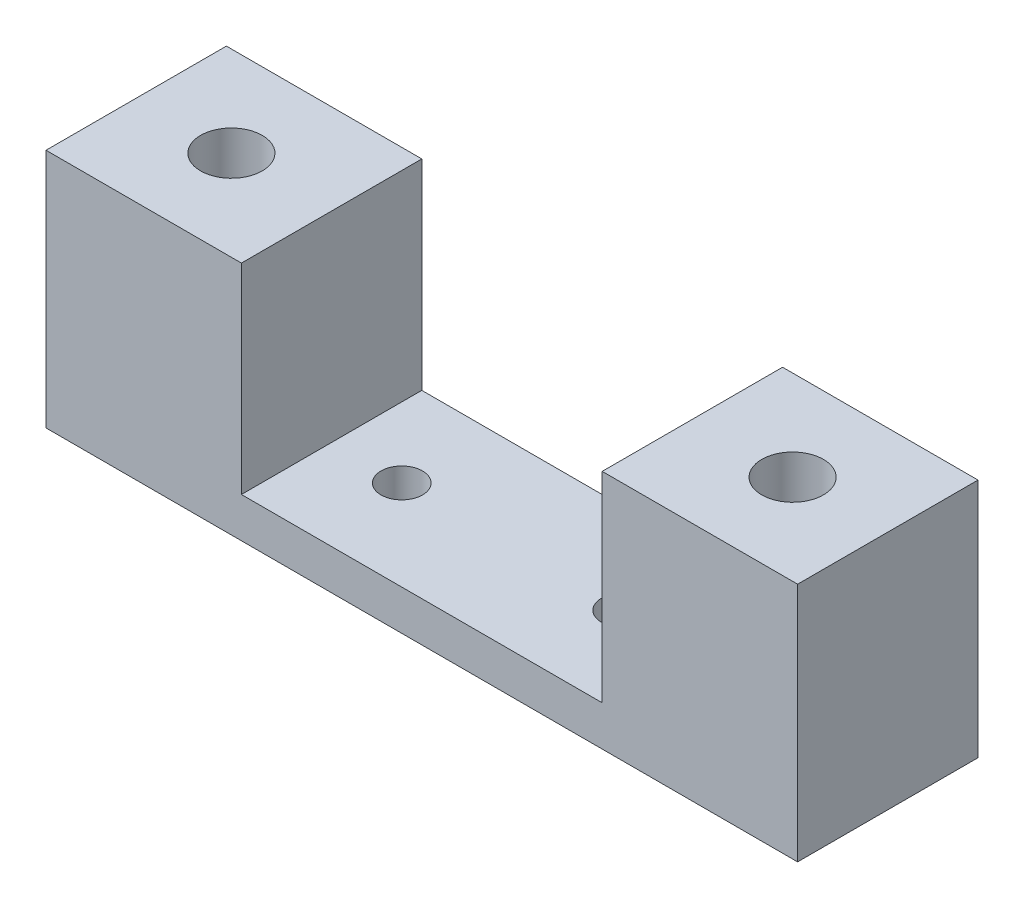
from build123d import *

# Parameters (mm, degrees)
SKETCH1_W           = 75
SKETCH1_H           = 18
BOSS_EXTRUDE1_DEPTH = 24
SKETCH2_W           = 36
SKETCH2_H           = 18
CUT_EXTRUDE1_DEPTH  = 20
CUT_EXTRUDE2_REACH  = 81.681
SKETCH3_R           = 2.075
CUT_EXTRUDE4_REACH  = 82.777
SKETCH4_R           = 3.075
CUT_EXTRUDE5_DEPTH  = 5


with BuildPart() as part:
    # Sketch1 → Boss-Extrude1 (new body)
    with BuildSketch(Plane(origin=(0, 0, 0), x_dir=(1, 0, 0), z_dir=(0, 1, 0))):
        with Locations((37.5, -9)):
            Rectangle(SKETCH1_W, SKETCH1_H)
    extrude(amount=BOSS_EXTRUDE1_DEPTH)

    # Sketch2 → Cut-Extrude1 (cut)
    with BuildSketch(Plane(origin=(0, 24, 0), x_dir=(1, 0, 0), z_dir=(0, 1, 0))):
        with Locations((37.5, -9)):
            Rectangle(SKETCH2_W, SKETCH2_H)
    extrude(amount=-CUT_EXTRUDE1_DEPTH, mode=Mode.SUBTRACT)

    # Sketch3 → Cut-Extrude2 (cut, up to next)
    with BuildSketch(Plane(origin=(0, 4, 0), x_dir=(1, 0, 0), z_dir=(0, 1, 0)), mode=Mode.PRIVATE) as cut_extrude2_sk1:
        with Locations(Location((26.5, -9, 0), (0, 0, 270))):
            Circle(SKETCH3_R)
    cut_extrude2_tool1 = extrude(cut_extrude2_sk1.sketch, amount=-CUT_EXTRUDE2_REACH, mode=Mode.PRIVATE) & part.part
    # Sketch3 → Cut-Extrude2 (cut, up to next)
    with BuildSketch(Plane(origin=(0, 4, 0), x_dir=(1, 0, 0), z_dir=(0, 1, 0)), mode=Mode.PRIVATE) as cut_extrude2_sk2:
        with Locations(Location((48.5, -9, 0), (0, 0, 270))):
            Circle(SKETCH3_R)
    cut_extrude2_tool2 = extrude(cut_extrude2_sk2.sketch, amount=-CUT_EXTRUDE2_REACH, mode=Mode.PRIVATE) & part.part
    add(cut_extrude2_tool1.solids().sort_by_distance((26.5, 4, 9))[0], mode=Mode.SUBTRACT)
    add(cut_extrude2_tool2.solids().sort_by_distance((48.5, 4, 9))[0], mode=Mode.SUBTRACT)

    # Sketch4 → Cut-Extrude4 (cut, up to next)
    with BuildSketch(Plane(origin=(0, 24, 0), x_dir=(1, 0, 0), z_dir=(0, 1, 0)), mode=Mode.PRIVATE) as cut_extrude4_sk1:
        with Locations(Location((9.5, -9, 0), (0, 0, 270))):
            Circle(SKETCH4_R)
    cut_extrude4_tool1 = extrude(cut_extrude4_sk1.sketch, amount=-CUT_EXTRUDE4_REACH, mode=Mode.PRIVATE) & part.part
    # Sketch4 → Cut-Extrude4 (cut, up to next)
    with BuildSketch(Plane(origin=(0, 24, 0), x_dir=(1, 0, 0), z_dir=(0, 1, 0)), mode=Mode.PRIVATE) as cut_extrude4_sk2:
        with Locations(Location((65.5, -9, 0), (0, 0, 270))):
            Circle(SKETCH4_R)
    cut_extrude4_tool2 = extrude(cut_extrude4_sk2.sketch, amount=-CUT_EXTRUDE4_REACH, mode=Mode.PRIVATE) & part.part
    add(cut_extrude4_tool1.solids().sort_by_distance((9.5, 24, 9))[0], mode=Mode.SUBTRACT)
    add(cut_extrude4_tool2.solids().sort_by_distance((65.5, 24, 9))[0], mode=Mode.SUBTRACT)

    # Sketch5 → Cut-Extrude5 (cut)
    with BuildSketch(Plane.XZ):
        Polygon((14.5, 11.886751346), (9.5, 14.773502692), (4.5, 11.886751346), (4.5, 6.113248654), (9.5, 3.226497308), (14.5, 6.113248654), align=None)
        Polygon((70.5, 6.113248654), (70.5, 11.886751346), (65.5, 14.773502692), (60.5, 11.886751346), (60.5, 6.113248654), (65.5, 3.226497308), align=None)
    extrude(amount=-CUT_EXTRUDE5_DEPTH, mode=Mode.SUBTRACT)


solid = part.part
